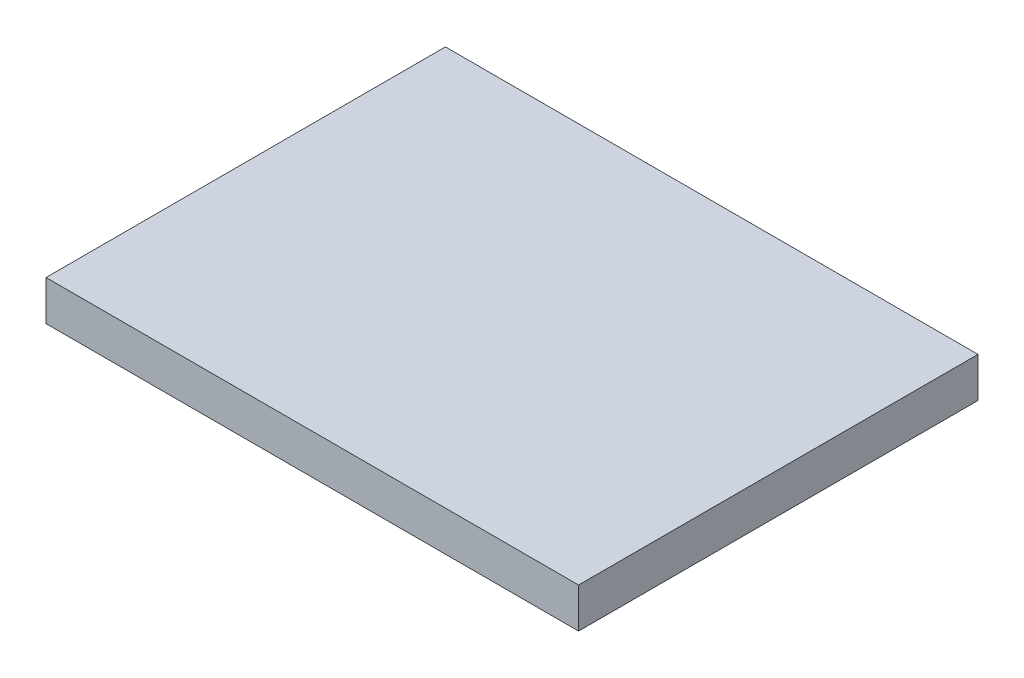
from build123d import *

# Parameters (mm, degrees)
SKETCH2_W           = 4000
SKETCH2_H           = 3000
BOSS_EXTRUDE1_DEPTH = 300


with BuildPart() as part:
    # Sketch2 → Boss-Extrude1 (new body)
    with BuildSketch(Plane(origin=(0, 0, 0), x_dir=(1, 0, 0), z_dir=(0, 1, 0))):
        with Locations((2000, 1500)):
            Rectangle(SKETCH2_W, SKETCH2_H)
    extrude(amount=BOSS_EXTRUDE1_DEPTH)


solid = part.part
